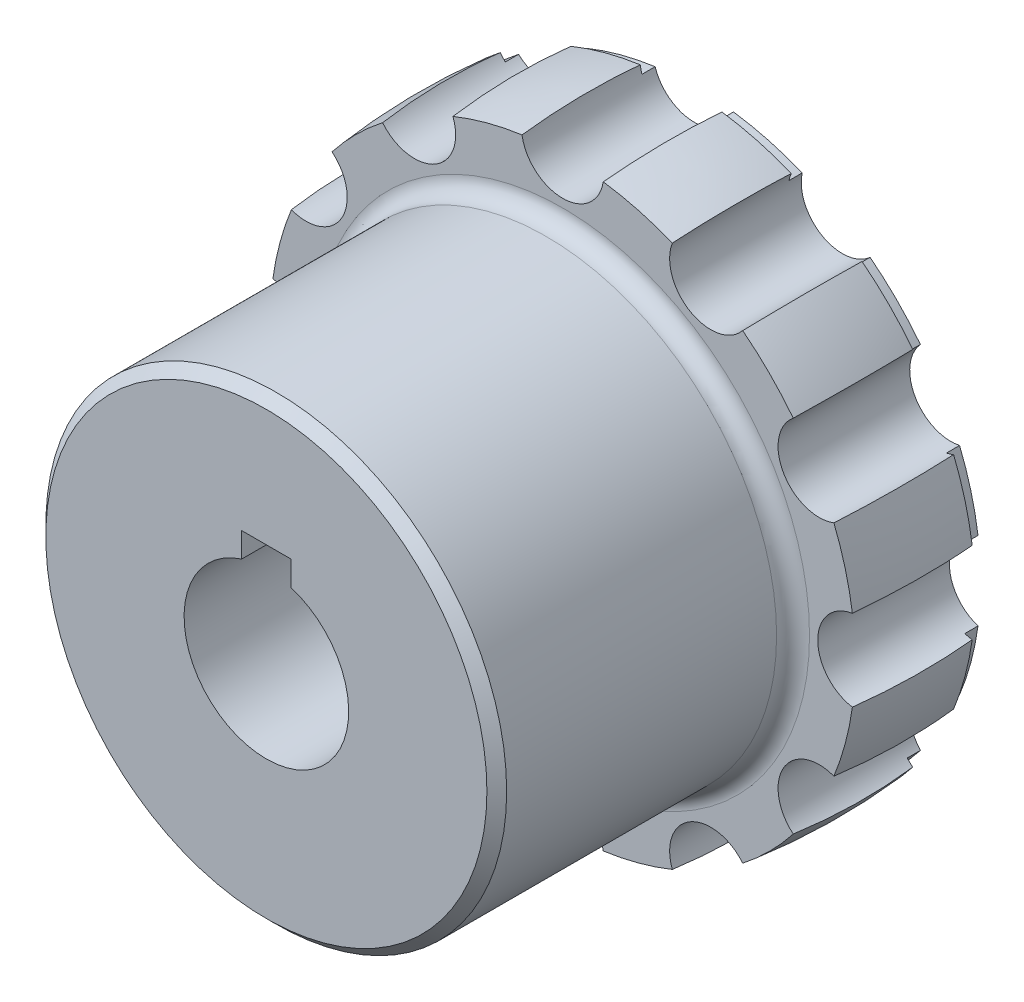
from build123d import *

# Parameters (mm, degrees)
SKETCH_1_R          = 130
EXTRUDE_1_DEPTH     = 40
SKETCH_2_R          = 70
EXTRUDE_2_DEPTH     = 130
SKETCH_4_R          = 12.5
CUT_EXTRUDE_1_DEPTH = 70
FILLET_1_R          = 5
CHAMFER_1_SIZE      = 3
SCALE_1_SCALE       = 0.2
CUT_EXTRUDE_3_DEPTH = 37.215474988


with BuildPart() as part:
    # 草图1 → 凸台-拉伸1 (new body)
    with BuildSketch(Plane.XY):
        Circle(SKETCH_1_R)
    extrude(amount=EXTRUDE_1_DEPTH)

    # 草图2 → 凸台-拉伸2 (add)
    with BuildSketch(Plane.XY):
        Circle(SKETCH_2_R)
    extrude(amount=EXTRUDE_2_DEPTH)

    # 草图3 → 切除-旋转1 (revolve, cut)
    with BuildSketch(Plane(origin=(0, 0, 0), x_dir=(1, 0, 0), z_dir=(0, 1, 0))):
        with BuildLine():
            Line((-87, 0), (-87, -4))
            Line((-87, -4), (-89.287478648, -4))
            ThreePointArc((-89.287478648, -4), (-89.988776291, -22.010076897), (-88.8854382, -40))
            Line((-88.8854382, -40), (-140, -40))
            Line((-140, -40), (-140, 0))
            Line((-140, 0), (-87, 0))
        make_face()
    revolve(axis=Axis((0, 0, -59.373086337), (0, 0, 1)), mode=Mode.SUBTRACT)

    # 草图4 → 切除-拉伸1 (cut)
    with BuildSketch(Plane.XY.offset(40)):
        with Locations((0, 90)):
            Circle(SKETCH_4_R)
        with Locations((45, 77.942286341)):
            Circle(SKETCH_4_R)
        with Locations((77.942286341, 45)):
            Circle(SKETCH_4_R)
        with Locations((90, 0)):
            Circle(SKETCH_4_R)
        with Locations((77.942286341, -45)):
            Circle(SKETCH_4_R)
        with Locations((45, -77.942286341)):
            Circle(SKETCH_4_R)
        with Locations((0, -90)):
            Circle(SKETCH_4_R)
        with Locations((-45, -77.942286341)):
            Circle(SKETCH_4_R)
        with Locations((-77.942286341, -45)):
            Circle(SKETCH_4_R)
        with Locations((-90, 0)):
            Circle(SKETCH_4_R)
        with Locations((-77.942286341, 45)):
            Circle(SKETCH_4_R)
        with Locations((-45, 77.942286341)):
            Circle(SKETCH_4_R)
    extrude(amount=-CUT_EXTRUDE_1_DEPTH, mode=Mode.SUBTRACT)

    # 圆角1
    fillet_1_edges = [part.edges().sort_by_distance(p)[0] for p in [
        (-70, 0, 40),
    ]]
    fillet(fillet_1_edges, radius=FILLET_1_R)

    # 倒角1
    chamfer_1_edges = [part.edges().sort_by_distance(p)[0] for p in [
        (-70, 0, 130),
    ]]
    chamfer(chamfer_1_edges, length=CHAMFER_1_SIZE)


with BuildPart() as part_1:
    # 缩放比例1: scaled about (0, 0, 59.385771994)
    add(part.part.scale(SCALE_1_SCALE).moved(Location((0, 0, 47.508617595))))

    # 草图8 → 切除-拉伸3 (cut, through all)
    with BuildSketch(Plane.XY.offset(73.508624031)):
        with BuildLine():
            Line((1.5, 4.769696007), (1.5, 6.269696007))
            Line((1.5, 6.269696007), (-1.5, 6.269696007))
            Line((-1.5, 6.269696007), (-1.5, 4.769696007))
            ThreePointArc((-1.5, 4.769696007), (0, -5), (1.5, 4.769696007))
        make_face()
    extrude(amount=-CUT_EXTRUDE_3_DEPTH, mode=Mode.SUBTRACT)


solid = part_1.part
